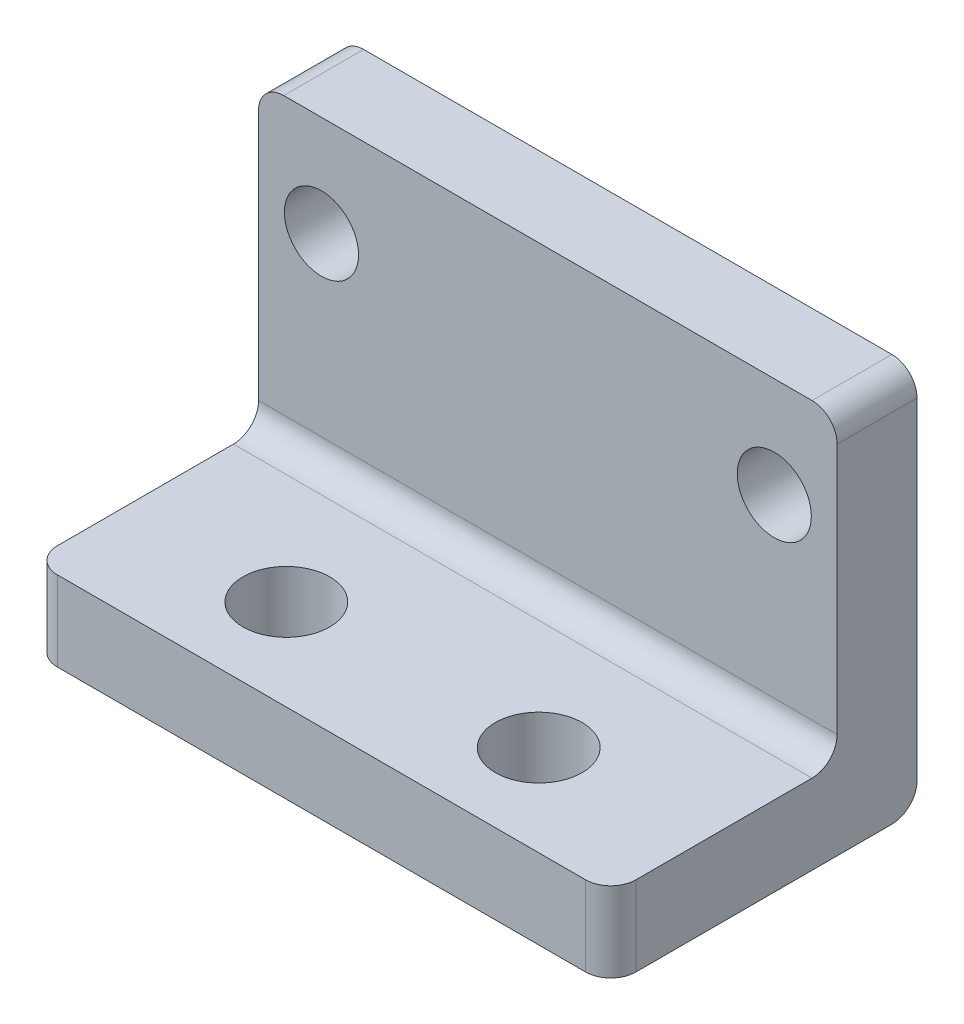
from build123d import *

# Parameters (mm, degrees)
SKETCH1_W             = 23
SKETCH1_H             = 10
SKETCH1_R             = 1.4732
SKETCH1_H_2           = 3.175
SKETCH1_H_3           = 2
BOSS_EXTRUDE1_DEPTH   = 3.175
BOSS_EXTRUDE2_START   = 3.175
SKETCH1_3_W           = 23
SKETCH1_3_H           = 3.175
BOSS_EXTRUDE2_DEPTH   = 9
F_8_32_TAPPED_HOLE1_D = 3.4544
FILLET1_R             = 1


with BuildPart() as part:
    # Sketch1 → Boss-Extrude1 (new body)
    # profile 1 of 3: a face of its own
    with BuildSketch(Plane.XY):
        with Locations((11.5, -5)):
            Rectangle(SKETCH1_W, SKETCH1_H)
        with Locations((2.5, -2)):
            Circle(SKETCH1_R, mode=Mode.SUBTRACT)
        with Locations((20.5, -2)):
            Circle(SKETCH1_R, mode=Mode.SUBTRACT)
    # profile 2 of 3: a face of its own
    with BuildSketch(Plane.XY):
        with Locations((11.5, -11.5875)):
            Rectangle(SKETCH1_W, SKETCH1_H_2)
    # profile 3 of 3: a face of its own
    with BuildSketch(Plane.XY):
        with Locations((11.5, 1)):
            Rectangle(SKETCH1_W, SKETCH1_H_3)
    extrude(amount=BOSS_EXTRUDE1_DEPTH)

    # Sketch1<3> → Boss-Extrude2 (add)
    with BuildSketch(Plane.XY.offset(BOSS_EXTRUDE2_START)):
        with Locations((11.5, -11.5875)):
            Rectangle(SKETCH1_3_W, SKETCH1_3_H)
    extrude(amount=BOSS_EXTRUDE2_DEPTH)

    # #8-32 Tapped Hole1 (through all)
    with Locations(Plane(origin=(6.4835, -10, 8.5555), x_dir=(1, 0, 0), z_dir=(0, 1, 0))):
        with Locations((0, 0), (10.033, 0)):
            Hole(F_8_32_TAPPED_HOLE1_D / 2)

    # Fillet1
    fillet1_edges = [part.edges().sort_by_distance(p)[0] for p in [
        (0, 2, 1.5875),
        (23, 2, 1.5875),
        (0, -11.5875, 12.175),
        (11.5, -10, 3.175),
        (23, -11.5875, 12.175),
        (11.5, -13.175, 0),
    ]]
    fillet(fillet1_edges, radius=FILLET1_R)


solid = part.part
